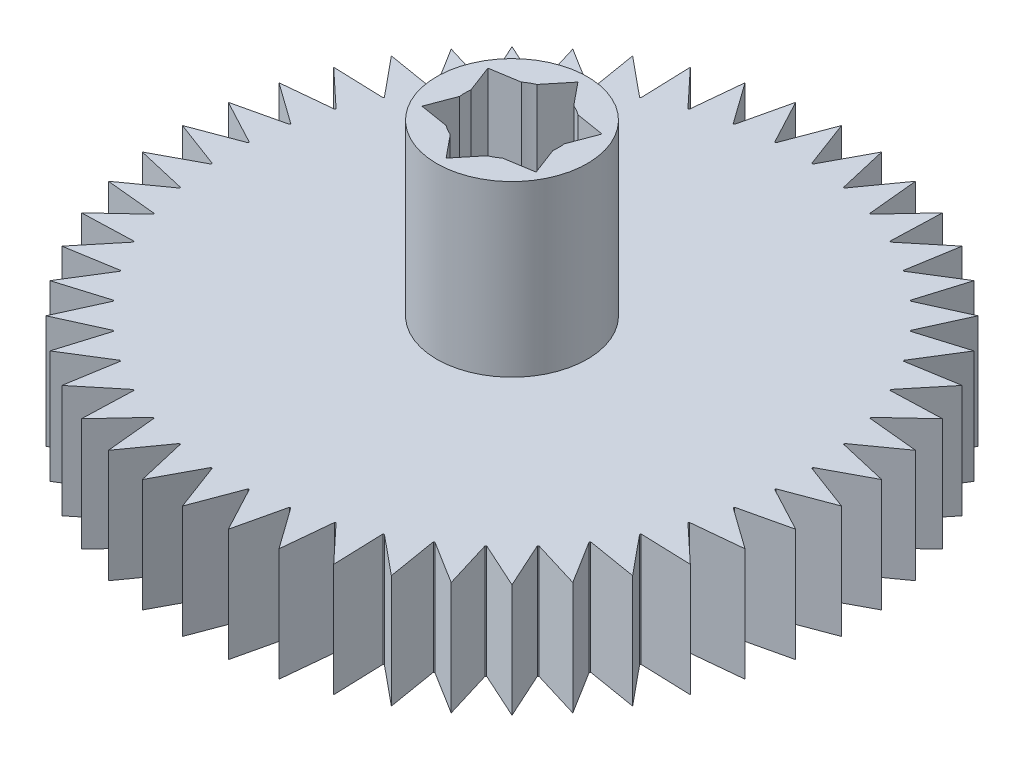
from build123d import *

# Parameters (mm, degrees)
EXTRUDE_5_DEPTH     = 6
EXTRUDE_6_DEPTH     = 6
SKETCH_6_R          = 4
EXTRUDE_9_DEPTH     = 5
EXTRUDE_START       = 9
SKETCH_4_R          = 4
EXTRUDE_10_DEPTH    = 9
CUT_EXTRUDE_1_DEPTH = 6


with BuildPart() as part:
    # Эскиз1 → Бобышка-Вытянуть5 (new body)
    with BuildSketch(Plane(origin=(0, 0, 0), x_dir=(1, 0, 0), z_dir=(0, 1, 0))):
        with BuildLine():
            Line((2.895366476, 14.71790926), (2.284208364, 17.350285074))
            Line((2.284208364, 17.350285074), (1.012565965, 14.965784649))
            ThreePointArc((1.012565965, 14.965784649), (0.981046938, 14.967883849), (0.949523561, 14.969916667))
            Line((0.949523561, 14.969916667), (0, 17.5))
            Line((0, 17.5), (-0.949523561, 14.969916667))
            ThreePointArc((-0.949523561, 14.969916667), (-0.981046938, 14.967883849), (-1.012565965, 14.965784649))
            Line((-1.012565965, 14.965784649), (-2.284208364, 17.350285074))
            Line((-2.284208364, 17.350285074), (-2.895366476, 14.71790926))
            ThreePointArc((-2.895366476, 14.71790926), (-2.92635483, 14.711779206), (-2.957330207, 14.705583907))
            Line((-2.957330207, 14.705583907), (-4.529333289, 16.90370196))
            Line((-4.529333289, 16.90370196), (-4.791668867, 14.214074344))
            ThreePointArc((-4.791668867, 14.214074344), (-4.82159198, 14.203951942), (-4.851493708, 14.193766547))
            Line((-4.851493708, 14.193766547), (-6.696960066, 16.167891819))
            Line((-6.696960066, 16.167891819), (-6.605984476, 13.467032676))
            ThreePointArc((-6.605984476, 13.467032676), (-6.634330353, 13.453091123), (-6.662646808, 13.439089906))
            Line((-6.662646808, 13.439089906), (-8.75, 15.155444566))
            Line((-8.75, 15.155444566), (-8.307269859, 12.489566345))
            ThreePointArc((-8.307269859, 12.489566345), (-8.333553495, 12.472044185), (-8.359800173, 12.454466711))
            Line((-8.359800173, 12.454466711), (-10.653325008, 13.883683455))
            Line((-10.653325008, 13.883683455), (-9.866415551, 11.298400071))
            ThreePointArc((-9.866415551, 11.298400071), (-9.890187227, 11.277597112), (-9.91391504, 11.256744138))
            Line((-9.91391504, 11.256744138), (-12.374368671, 12.374368671))
            Line((-12.374368671, 12.374368671), (-11.256744138, 9.91391504))
            ThreePointArc((-11.256744138, 9.91391504), (-11.277597112, 9.890187227), (-11.298400071, 9.866415551))
            Line((-11.298400071, 9.866415551), (-13.883683455, 10.653325008))
            Line((-13.883683455, 10.653325008), (-12.454466711, 8.359800173))
            ThreePointArc((-12.454466711, 8.359800173), (-12.472044185, 8.333553495), (-12.489566345, 8.307269859))
            Line((-12.489566345, 8.307269859), (-15.155444566, 8.75))
            Line((-15.155444566, 8.75), (-13.439089906, 6.662646808))
            ThreePointArc((-13.439089906, 6.662646808), (-13.453091123, 6.634330353), (-13.467032676, 6.605984476))
            Line((-13.467032676, 6.605984476), (-16.167891819, 6.696960066))
            Line((-16.167891819, 6.696960066), (-14.193766547, 4.851493708))
            ThreePointArc((-14.193766547, 4.851493708), (-14.203951942, 4.82159198), (-14.214074344, 4.791668867))
            Line((-14.214074344, 4.791668867), (-16.90370196, 4.529333289))
            Line((-16.90370196, 4.529333289), (-14.705583907, 2.957330207))
            ThreePointArc((-14.705583907, 2.957330207), (-14.711779206, 2.92635483), (-14.71790926, 2.895366476))
            Line((-14.71790926, 2.895366476), (-17.350285074, 2.284208364))
            Line((-17.350285074, 2.284208364), (-14.965784649, 1.012565965))
            ThreePointArc((-14.965784649, 1.012565965), (-14.967883849, 0.981046938), (-14.969916667, 0.949523561))
            Line((-14.969916667, 0.949523561), (-17.5, 0))
            Line((-17.5, 0), (-14.969916667, -0.949523561))
            ThreePointArc((-14.969916667, -0.949523561), (-14.967883849, -0.981046938), (-14.965784649, -1.012565965))
            Line((-14.965784649, -1.012565965), (-17.350285074, -2.284208364))
            Line((-17.350285074, -2.284208364), (-14.71790926, -2.895366476))
            ThreePointArc((-14.71790926, -2.895366476), (-14.711779206, -2.92635483), (-14.705583907, -2.957330207))
            Line((-14.705583907, -2.957330207), (-16.90370196, -4.529333289))
            Line((-16.90370196, -4.529333289), (-14.214074344, -4.791668867))
            ThreePointArc((-14.214074344, -4.791668867), (-14.203951942, -4.82159198), (-14.193766547, -4.851493708))
            Line((-14.193766547, -4.851493708), (-16.167891819, -6.696960066))
            Line((-16.167891819, -6.696960066), (-13.467032676, -6.605984476))
            ThreePointArc((-13.467032676, -6.605984476), (-13.453091123, -6.634330353), (-13.439089906, -6.662646808))
            Line((-13.439089906, -6.662646808), (-15.155444566, -8.75))
            Line((-15.155444566, -8.75), (-12.489566345, -8.307269859))
            ThreePointArc((-12.489566345, -8.307269859), (-12.472044185, -8.333553495), (-12.454466711, -8.359800173))
            Line((-12.454466711, -8.359800173), (-13.883683455, -10.653325008))
            Line((-13.883683455, -10.653325008), (-11.298400071, -9.866415551))
            ThreePointArc((-11.298400071, -9.866415551), (-11.277597112, -9.890187227), (-11.256744138, -9.91391504))
            Line((-11.256744138, -9.91391504), (-12.374368671, -12.374368671))
            Line((-12.374368671, -12.374368671), (-9.91391504, -11.256744138))
            ThreePointArc((-9.91391504, -11.256744138), (-9.890187227, -11.277597112), (-9.866415551, -11.298400071))
            Line((-9.866415551, -11.298400071), (-10.653325008, -13.883683455))
            Line((-10.653325008, -13.883683455), (-8.359800173, -12.454466711))
            ThreePointArc((-8.359800173, -12.454466711), (-8.333553495, -12.472044185), (-8.307269859, -12.489566345))
            Line((-8.307269859, -12.489566345), (-8.75, -15.155444566))
            Line((-8.75, -15.155444566), (-6.662646808, -13.439089906))
            ThreePointArc((-6.662646808, -13.439089906), (-6.634330353, -13.453091123), (-6.605984476, -13.467032676))
            Line((-6.605984476, -13.467032676), (-6.696960066, -16.167891819))
            Line((-6.696960066, -16.167891819), (-4.851493708, -14.193766547))
            ThreePointArc((-4.851493708, -14.193766547), (-4.82159198, -14.203951942), (-4.791668867, -14.214074344))
            Line((-4.791668867, -14.214074344), (-4.529333289, -16.90370196))
            Line((-4.529333289, -16.90370196), (-2.957330207, -14.705583907))
            ThreePointArc((-2.957330207, -14.705583907), (-2.92635483, -14.711779206), (-2.895366476, -14.71790926))
            Line((-2.895366476, -14.71790926), (-2.284208364, -17.350285074))
            Line((-2.284208364, -17.350285074), (-1.012565965, -14.965784649))
            ThreePointArc((-1.012565965, -14.965784649), (-0.981046938, -14.967883849), (-0.949523561, -14.969916667))
            Line((-0.949523561, -14.969916667), (0, -17.5))
            Line((0, -17.5), (0.949523561, -14.969916667))
            ThreePointArc((0.949523561, -14.969916667), (0.981046938, -14.967883849), (1.012565965, -14.965784649))
            Line((1.012565965, -14.965784649), (2.284208364, -17.350285074))
            Line((2.284208364, -17.350285074), (2.895366476, -14.71790926))
            ThreePointArc((2.895366476, -14.71790926), (2.92635483, -14.711779206), (2.957330207, -14.705583907))
            Line((2.957330207, -14.705583907), (4.529333289, -16.90370196))
            Line((4.529333289, -16.90370196), (4.791668867, -14.214074344))
            ThreePointArc((4.791668867, -14.214074344), (4.82159198, -14.203951942), (4.851493708, -14.193766547))
            Line((4.851493708, -14.193766547), (6.696960066, -16.167891819))
            Line((6.696960066, -16.167891819), (6.605984476, -13.467032676))
            ThreePointArc((6.605984476, -13.467032676), (6.634330353, -13.453091123), (6.662646808, -13.439089906))
            Line((6.662646808, -13.439089906), (8.75, -15.155444566))
            Line((8.75, -15.155444566), (8.307269859, -12.489566345))
            ThreePointArc((8.307269859, -12.489566345), (8.333553495, -12.472044185), (8.359800173, -12.454466711))
            Line((8.359800173, -12.454466711), (10.653325008, -13.883683455))
            Line((10.653325008, -13.883683455), (9.866415551, -11.298400071))
            ThreePointArc((9.866415551, -11.298400071), (9.890187227, -11.277597112), (9.91391504, -11.256744138))
            Line((9.91391504, -11.256744138), (12.374368671, -12.374368671))
            Line((12.374368671, -12.374368671), (11.256744138, -9.91391504))
            ThreePointArc((11.256744138, -9.91391504), (11.277597112, -9.890187227), (11.298400071, -9.866415551))
            Line((11.298400071, -9.866415551), (13.883683455, -10.653325008))
            Line((13.883683455, -10.653325008), (12.454466711, -8.359800173))
            ThreePointArc((12.454466711, -8.359800173), (12.472044185, -8.333553495), (12.489566345, -8.307269859))
            Line((12.489566345, -8.307269859), (15.155444566, -8.75))
            Line((15.155444566, -8.75), (13.439089906, -6.662646808))
            ThreePointArc((13.439089906, -6.662646808), (13.453091123, -6.634330353), (13.467032676, -6.605984476))
            Line((13.467032676, -6.605984476), (16.167891819, -6.696960066))
            Line((16.167891819, -6.696960066), (14.193766547, -4.851493708))
            ThreePointArc((14.193766547, -4.851493708), (14.203951942, -4.82159198), (14.214074344, -4.791668867))
            Line((14.214074344, -4.791668867), (16.90370196, -4.529333289))
            Line((16.90370196, -4.529333289), (14.705583907, -2.957330207))
            ThreePointArc((14.705583907, -2.957330207), (14.711779206, -2.92635483), (14.71790926, -2.895366476))
            Line((14.71790926, -2.895366476), (17.350285074, -2.284208364))
            Line((17.350285074, -2.284208364), (14.965784649, -1.012565965))
            ThreePointArc((14.965784649, -1.012565965), (14.967883849, -0.981046938), (14.969916667, -0.949523561))
            Line((14.969916667, -0.949523561), (17.5, 0))
            Line((17.5, 0), (14.969916667, 0.949523561))
            ThreePointArc((14.969916667, 0.949523561), (14.967883849, 0.981046938), (14.965784649, 1.012565965))
            Line((14.965784649, 1.012565965), (17.350285074, 2.284208364))
            Line((17.350285074, 2.284208364), (14.71790926, 2.895366476))
            ThreePointArc((14.71790926, 2.895366476), (14.711779206, 2.92635483), (14.705583907, 2.957330207))
            Line((14.705583907, 2.957330207), (16.90370196, 4.529333289))
            Line((16.90370196, 4.529333289), (14.214074344, 4.791668867))
            ThreePointArc((14.214074344, 4.791668867), (14.203951942, 4.82159198), (14.193766547, 4.851493708))
            Line((14.193766547, 4.851493708), (16.167891819, 6.696960066))
            Line((16.167891819, 6.696960066), (13.467032676, 6.605984476))
            ThreePointArc((13.467032676, 6.605984476), (13.453091123, 6.634330353), (13.439089906, 6.662646808))
            Line((13.439089906, 6.662646808), (15.155444566, 8.75))
            Line((15.155444566, 8.75), (12.489566345, 8.307269859))
            ThreePointArc((12.489566345, 8.307269859), (12.472044185, 8.333553495), (12.454466711, 8.359800173))
            Line((12.454466711, 8.359800173), (13.883683455, 10.653325008))
            Line((13.883683455, 10.653325008), (11.298400071, 9.866415551))
            ThreePointArc((11.298400071, 9.866415551), (11.277597112, 9.890187227), (11.256744138, 9.91391504))
            Line((11.256744138, 9.91391504), (12.374368671, 12.374368671))
            Line((12.374368671, 12.374368671), (9.91391504, 11.256744138))
            ThreePointArc((9.91391504, 11.256744138), (9.890187227, 11.277597112), (9.866415551, 11.298400071))
            Line((9.866415551, 11.298400071), (10.653325008, 13.883683455))
            Line((10.653325008, 13.883683455), (8.359800173, 12.454466711))
            ThreePointArc((8.359800173, 12.454466711), (8.333553495, 12.472044185), (8.307269859, 12.489566345))
            Line((8.307269859, 12.489566345), (8.75, 15.155444566))
            Line((8.75, 15.155444566), (6.662646808, 13.439089906))
            ThreePointArc((6.662646808, 13.439089906), (6.634330353, 13.453091123), (6.605984476, 13.467032676))
            Line((6.605984476, 13.467032676), (6.696960066, 16.167891819))
            Line((6.696960066, 16.167891819), (4.851493708, 14.193766547))
            ThreePointArc((4.851493708, 14.193766547), (4.82159198, 14.203951942), (4.791668867, 14.214074344))
            Line((4.791668867, 14.214074344), (4.529333289, 16.90370196))
            Line((4.529333289, 16.90370196), (2.957330207, 14.705583907))
            ThreePointArc((2.957330207, 14.705583907), (2.92635483, 14.711779206), (2.895366476, 14.71790926))
        make_face()
        with BuildLine():
            ThreePointArc((2.2, 1.5), (2.517970617, 0), (2.2, -1.5))
            Line((2.2, -1.5), (-2.2, -1.5))
            ThreePointArc((-2.2, -1.5), (-2.493941045, 0), (-2.2, 1.5))
            Line((-2.2, 1.5), (2.2, 1.5))
        make_face(mode=Mode.SUBTRACT)
    extrude(amount=EXTRUDE_5_DEPTH)

    # Эскиз1<5> → Бобышка-Вытянуть6 (add)
    with BuildSketch(Plane(origin=(0, 0, 0), x_dir=(1, 0, 0), z_dir=(0, 1, 0))):
        with BuildLine():
            Line((0, 1.5), (2.2, 1.5))
            ThreePointArc((2.2, 1.5), (2.517970617, 0), (2.2, -1.5))
            Line((2.2, -1.5), (0, -1.5))
            Line((0, -1.5), (-2.2, -1.5))
            ThreePointArc((-2.2, -1.5), (-2.493941045, 0), (-2.2, 1.5))
            Line((-2.2, 1.5), (0, 1.5))
        make_face()
    extrude(amount=EXTRUDE_6_DEPTH)

    # Эскиз6 → Бобышка-Вытянуть9 (add)
    with BuildSketch(Plane(origin=(0, 0, 0), x_dir=(-1, 0, 0), z_dir=(0, -1, 0))):
        Circle(SKETCH_6_R)
    extrude(amount=EXTRUDE_9_DEPTH)

    # Эскиз4 → Бобышка-Вытянуть10 (add)
    with BuildSketch(Plane(origin=(0, 6, 0), x_dir=(1, 0, 0), z_dir=(0, 1, 0)).offset(EXTRUDE_START)):
        Circle(SKETCH_4_R)
    extrude(amount=-EXTRUDE_10_DEPTH)

    # Эскиз7 → Вырез-Вытянуть1 (cut)
    with BuildSketch(Plane(origin=(0, 15, 0), x_dir=(1, 0, 0), z_dir=(0, 1, 0))):
        with BuildLine():
            Line((3.031088913, 1.75), (1.50196048, 1.998528137))
            ThreePointArc((1.50196048, 1.998528137), (1.25, 2.165063509), (0.979795897, 2.3))
            Line((0.979795897, 2.3), (0, 3.5))
            Line((0, 3.5), (-0.979795897, 2.3))
            ThreePointArc((-0.979795897, 2.3), (-1.25, 2.165063509), (-1.50196048, 1.998528137))
            Line((-1.50196048, 1.998528137), (-3.031088913, 1.75))
            Line((-3.031088913, 1.75), (-2.481756377, 0.301471863))
            ThreePointArc((-2.481756377, 0.301471863), (-2.5, 0), (-2.481756377, -0.301471863))
            Line((-2.481756377, -0.301471863), (-3.031088913, -1.75))
            Line((-3.031088913, -1.75), (-1.50196048, -1.998528137))
            ThreePointArc((-1.50196048, -1.998528137), (-1.25, -2.165063509), (-0.979795897, -2.3))
            Line((-0.979795897, -2.3), (0, -3.5))
            Line((0, -3.5), (0.979795897, -2.3))
            ThreePointArc((0.979795897, -2.3), (1.25, -2.165063509), (1.50196048, -1.998528137))
            Line((1.50196048, -1.998528137), (3.031088913, -1.75))
            Line((3.031088913, -1.75), (2.481756377, -0.301471863))
            ThreePointArc((2.481756377, -0.301471863), (2.5, 0), (2.481756377, 0.301471863))
            Line((2.481756377, 0.301471863), (3.031088913, 1.75))
        make_face()
    extrude(amount=-CUT_EXTRUDE_1_DEPTH, mode=Mode.SUBTRACT)


solid = part.part
